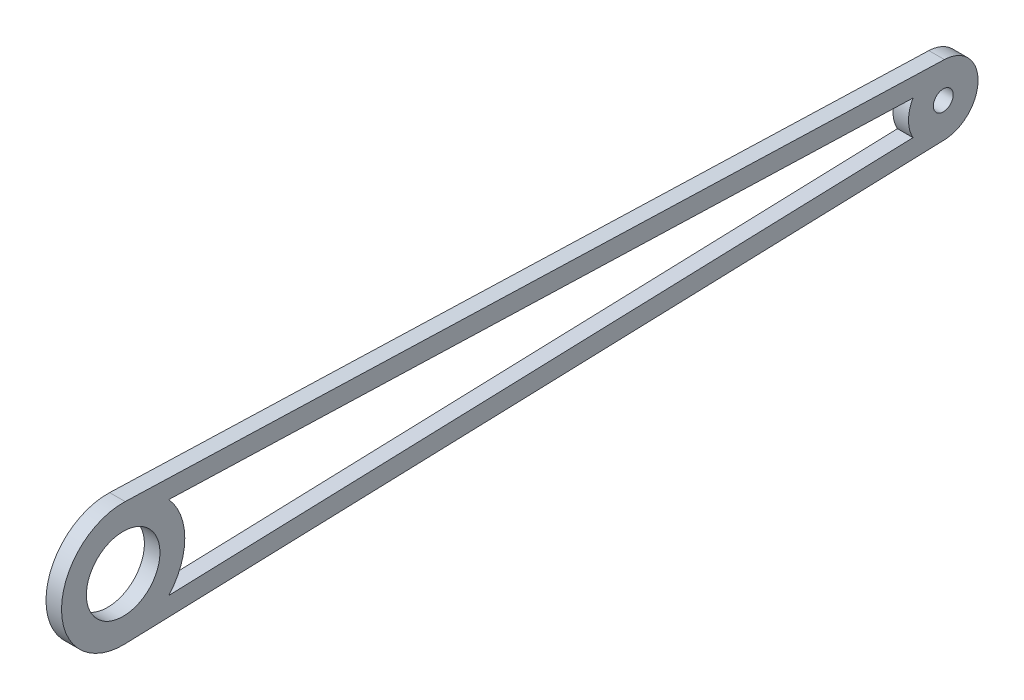
from build123d import *

# Parameters (mm, degrees)
SKETCH1_R           = 1.016
SKETCH1_R_2         = 3.7592
BOSS_EXTRUDE1_DEPTH = 1.5875


with BuildPart() as part:
    # Sketch1 → Boss-Extrude1 (new body)
    with BuildSketch(Plane(origin=(0, 0, 0), x_dir=(0, 0, -1), z_dir=(1, 0, 0))):
        with BuildLine():
            Line((83.936378182, 3.55409512), (0.206155636, 6.29582564))
            ThreePointArc((0.206155636, 6.29582564), (-6.2992, 9e-09), (0.206155618, -6.295825641))
            Line((0.206155618, -6.295825641), (83.936378182, -3.55409512))
            ThreePointArc((83.936378182, -3.55409512), (87.376, 0), (83.936378182, 3.55409512))
        make_face()
        with BuildLine():
            ThreePointArc((4.654808766, -4.244134305), (6.2992, 0), (4.654808766, 4.244134305))
            Line((4.654808766, 4.244134305), (80.726222273, 1.753190057))
            ThreePointArc((80.726222273, 1.753190057), (80.264, 0), (80.726222273, -1.753190057))
            Line((80.726222273, -1.753190057), (4.654808766, -4.244134305))
        make_face(mode=Mode.SUBTRACT)
        with Locations((83.82, 0)):
            Circle(SKETCH1_R, mode=Mode.SUBTRACT)
        Circle(SKETCH1_R_2, mode=Mode.SUBTRACT)
    extrude(amount=BOSS_EXTRUDE1_DEPTH)


solid = part.part
